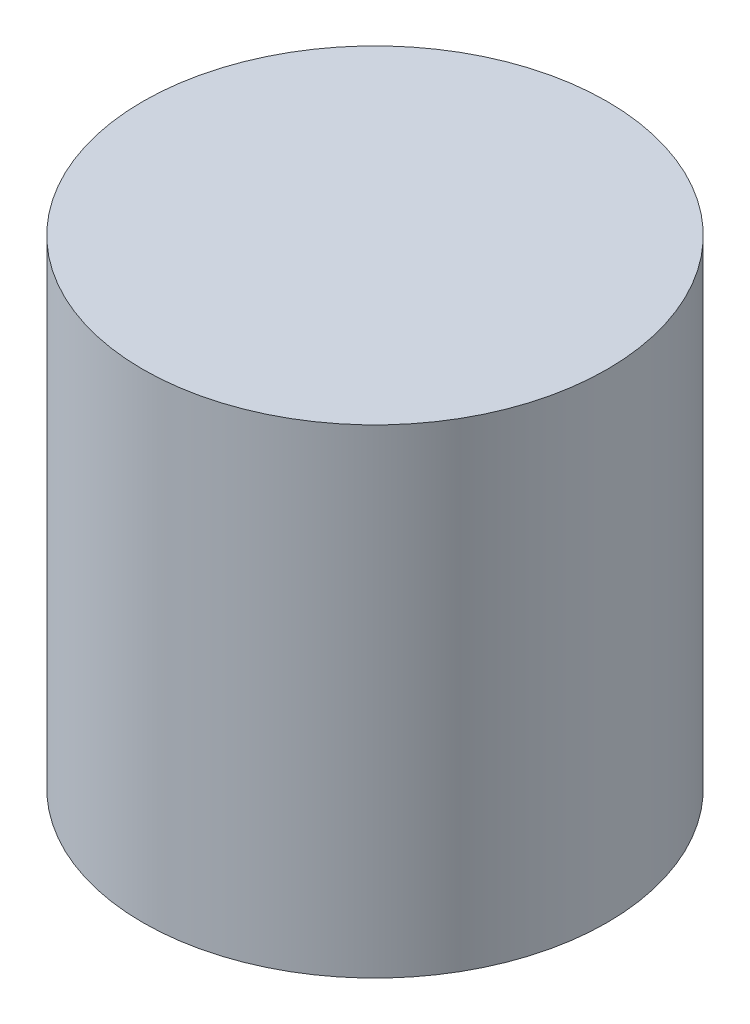
from build123d import *

# Parameters (mm, degrees)
SKETCH_1_R      = 10
EXTRUDE_1_DEPTH = 20.64


with BuildPart() as part:
    # Эскиз1 → Бобышка-Вытянуть1 (new body)
    with BuildSketch(Plane(origin=(0, 0, 0), x_dir=(1, 0, 0), z_dir=(0, 1, 0))):
        with Locations(Location((0, 0, 0), (0, 0, 270))):
            Circle(SKETCH_1_R)
    extrude(amount=-EXTRUDE_1_DEPTH)


solid = part.part
